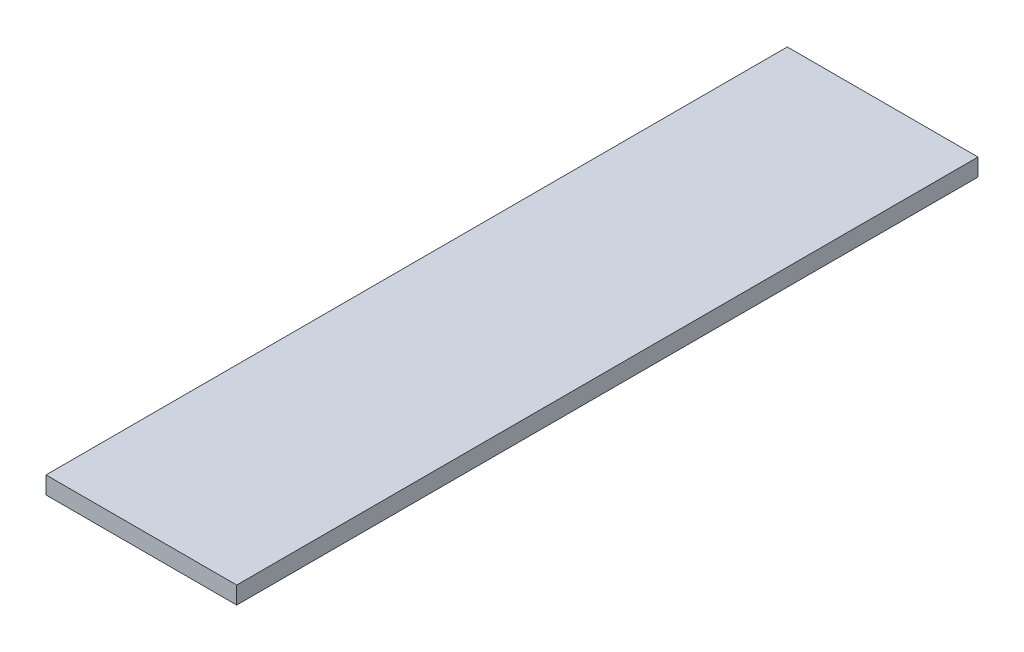
from build123d import *

# Parameters (mm, degrees)
SKETCH1_W           = 209.098719395
SKETCH1_H           = 19.05
BOSS_EXTRUDE1_DEPTH = 812.8


with BuildPart() as part:
    # Sketch1 → Boss-Extrude1 (new body)
    with BuildSketch(Plane.XY):
        with Locations((-632.635138553, 1853.471787186)):
            Rectangle(SKETCH1_W, SKETCH1_H)
    extrude(amount=BOSS_EXTRUDE1_DEPTH)


solid = part.part
